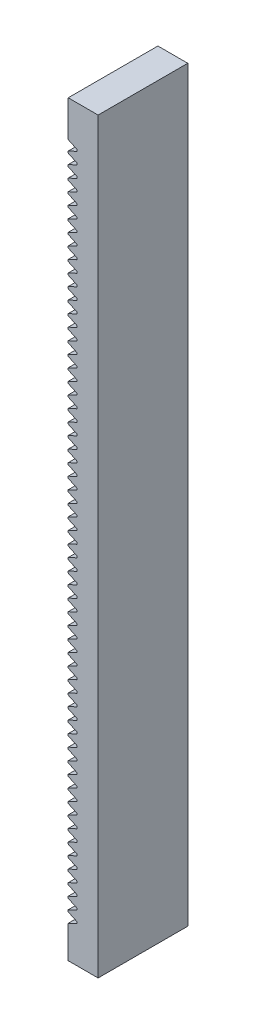
from build123d import *

# Parameters (mm, degrees)
EXTRUDE1_DEPTH = 24


with BuildPart() as part:
    # Sketch1 → Extrude1 (new body)
    with BuildSketch(Plane.XY):
        Polygon((-39.802495292, 39.802495292), (-39.802495292, 30.102495292), (-37.502495292, 29.032495292), (-37.502495292, 28.532495292), (-39.802495292, 27.462495292), (-39.802495292, 26.962495292), (-37.502495292, 25.892495292), (-37.502495292, 25.392495292), (-39.802495292, 24.322495292), (-39.802495292, 23.822495292), (-37.502495292, 22.752495292), (-37.502495292, 22.252495292), (-39.802495292, 21.182495292), (-39.802495292, 20.682495292), (-37.502495292, 19.612495292), (-37.502495292, 19.112495292), (-39.802495292, 18.042495292), (-39.802495292, 17.542495292), (-37.502495292, 16.472495292), (-37.502495292, 15.972495292), (-39.802495292, 14.902495292), (-39.802495292, 14.402495292), (-37.502495292, 13.332495292), (-37.502495292, 12.832495292), (-39.802495292, 11.762495292), (-39.802495292, 11.262495292), (-37.502495292, 10.192495292), (-37.502495292, 9.692495292), (-39.802495292, 8.622495292), (-39.802495292, 8.122495292), (-37.502495292, 7.052495292), (-37.502495292, 6.552495292), (-39.802495292, 5.482495292), (-39.802495292, 4.982495292), (-37.502495292, 3.912495292), (-37.502495292, 3.412495292), (-39.802495292, 2.342495292), (-39.802495292, 1.842495292), (-37.502495292, 0.772495292), (-37.502495292, 0.272495292), (-39.802495292, -0.797504708), (-39.802495292, -1.297504708), (-37.502495292, -2.367504708), (-37.502495292, -2.867504708), (-39.802495292, -3.937504708), (-39.802495292, -4.437504708), (-37.502495292, -5.507504708), (-37.502495292, -6.007504708), (-39.802495292, -7.077504708), (-39.802495292, -7.577504708), (-37.502495292, -8.647504708), (-37.502495292, -9.147504708), (-39.802495292, -10.217504708), (-39.802495292, -10.717504708), (-37.502495292, -11.787504708), (-37.502495292, -12.287504708), (-39.802495292, -13.357504708), (-39.802495292, -13.857504708), (-37.502495292, -14.927504708), (-37.502495292, -15.427504708), (-39.802495292, -16.497504708), (-39.802495292, -16.997504708), (-37.502495292, -18.067504708), (-37.502495292, -18.567504708), (-39.802495292, -19.637504708), (-39.802495292, -20.137504708), (-37.502495292, -21.207504708), (-37.502495292, -21.707504708), (-39.802495292, -22.777504708), (-39.802495292, -23.277504708), (-37.502495292, -24.347504708), (-37.502495292, -24.847504708), (-39.802495292, -25.917504708), (-39.802495292, -26.417504708), (-37.502495292, -27.487504708), (-37.502495292, -27.987504708), (-39.802495292, -29.057504708), (-39.802495292, -29.557504708), (-37.502495292, -30.627504708), (-37.502495292, -31.127504708), (-39.802495292, -32.197504708), (-39.802495292, -32.697504708), (-37.502495292, -33.767504708), (-37.502495292, -34.267504708), (-39.802495292, -35.337504708), (-39.802495292, -35.837504708), (-37.502495292, -36.907504708), (-37.502495292, -37.407504708), (-39.802495292, -38.477504708), (-39.802495292, -38.977504708), (-37.502495292, -40.047504708), (-37.502495292, -40.547504708), (-39.802495292, -41.617504708), (-39.802495292, -42.117504708), (-37.502495292, -43.187504708), (-37.502495292, -43.687504708), (-39.802495292, -44.757504708), (-39.802495292, -45.257504708), (-37.502495292, -46.327504708), (-37.502495292, -46.827504708), (-39.802495292, -47.897504708), (-39.802495292, -48.397504708), (-37.502495292, -49.467504708), (-37.502495292, -49.967504708), (-39.802495292, -51.037504708), (-39.802495292, -51.537504708), (-37.502495292, -52.607504708), (-37.502495292, -53.107504708), (-39.802495292, -54.177504708), (-39.802495292, -54.677504708), (-37.502495292, -55.747504708), (-37.502495292, -56.247504708), (-39.802495292, -57.317504708), (-39.802495292, -57.817504708), (-37.502495292, -58.887504708), (-37.502495292, -59.387504708), (-39.802495292, -60.457504708), (-39.802495292, -60.957504708), (-37.502495292, -62.027504708), (-37.502495292, -62.527504708), (-39.802495292, -63.597504708), (-39.802495292, -64.097504708), (-37.502495292, -65.167504708), (-37.502495292, -65.667504708), (-39.802495292, -66.737504708), (-39.802495292, -67.237504708), (-37.502495292, -68.307504708), (-37.502495292, -68.807504708), (-39.802495292, -69.877504708), (-39.802495292, -70.377504708), (-37.502495292, -71.447504708), (-37.502495292, -71.947504708), (-39.802495292, -73.017504708), (-39.802495292, -73.517504708), (-37.502495292, -74.587504708), (-37.502495292, -75.087504708), (-39.802495292, -76.157504708), (-39.802495292, -76.657504708), (-37.502495292, -77.727504708), (-37.502495292, -78.227504708), (-39.802495292, -79.297504708), (-39.802495292, -79.797504708), (-37.502495292, -80.867504708), (-37.502495292, -81.367504708), (-39.802495292, -82.437504708), (-39.802495292, -82.937504708), (-37.502495292, -84.007504708), (-37.502495292, -84.507504708), (-39.802495292, -85.577504708), (-39.802495292, -86.077504708), (-37.502495292, -87.147504708), (-37.502495292, -87.647504708), (-39.802495292, -88.717504708), (-39.802495292, -89.217504708), (-37.502495292, -90.287504708), (-37.502495292, -90.787504708), (-39.802495292, -91.857504708), (-39.802495292, -92.357504708), (-37.502495292, -93.427504708), (-37.502495292, -93.927504708), (-39.802495292, -94.997504708), (-39.802495292, -95.497504708), (-37.502495292, -96.567504708), (-37.502495292, -97.067504708), (-39.802495292, -98.137504708), (-39.802495292, -98.637504708), (-37.502495292, -99.707504708), (-37.502495292, -100.207504708), (-39.802495292, -101.277504708), (-39.802495292, -101.777504708), (-37.502495292, -102.847504708), (-37.502495292, -103.347504708), (-39.802495292, -104.417504708), (-39.802495292, -104.917504708), (-37.502495292, -105.987504708), (-37.502495292, -106.487504708), (-39.802495292, -107.557504708), (-39.802495292, -108.057504708), (-37.502495292, -109.127504708), (-37.502495292, -109.627504708), (-39.802495292, -110.697504708), (-39.802495292, -111.197504708), (-37.502495292, -112.267504708), (-37.502495292, -112.767504708), (-39.802495292, -113.837504708), (-39.802495292, -114.337504708), (-37.502495292, -115.407504708), (-37.502495292, -115.907504708), (-39.802495292, -116.977504708), (-39.802495292, -117.477504708), (-37.502495292, -118.547504708), (-37.502495292, -119.047504708), (-39.802495292, -120.117504708), (-39.802495292, -120.617504708), (-37.502495292, -121.687504708), (-37.502495292, -122.187504708), (-39.802495292, -123.257504708), (-39.802495292, -123.757504708), (-37.502495292, -124.827504708), (-37.502495292, -125.327504708), (-39.802495292, -126.397504708), (-39.802495292, -126.897504708), (-37.502495292, -127.967504708), (-37.502495292, -128.467504708), (-39.802495292, -129.537504708), (-39.802495292, -130.037504708), (-37.502495292, -131.107504708), (-37.502495292, -131.607504708), (-39.802495292, -132.677504708), (-39.802495292, -133.177504708), (-37.502495292, -134.247504708), (-37.502495292, -134.747504708), (-39.802495292, -135.817504708), (-39.802495292, -136.317504708), (-37.502495292, -137.387504708), (-37.502495292, -137.887504708), (-39.802495292, -138.957504708), (-39.802495292, -139.457504708), (-37.502495292, -140.527504708), (-37.502495292, -141.027504708), (-39.802495292, -142.097504708), (-39.802495292, -142.597504708), (-37.502495292, -143.667504708), (-37.502495292, -144.167504708), (-39.802495292, -145.237504708), (-39.802495292, -145.737504708), (-37.502495292, -146.807504708), (-37.502495292, -147.307504708), (-39.802495292, -148.377504708), (-39.802495292, -148.877504708), (-37.502495292, -149.947504708), (-37.502495292, -150.447504708), (-39.802495292, -151.517504708), (-39.802495292, -160.197504708), (-31.802495292, -160.197504708), (-31.802495292, 39.802495292), align=None)
    extrude(amount=-EXTRUDE1_DEPTH)


solid = part.part
